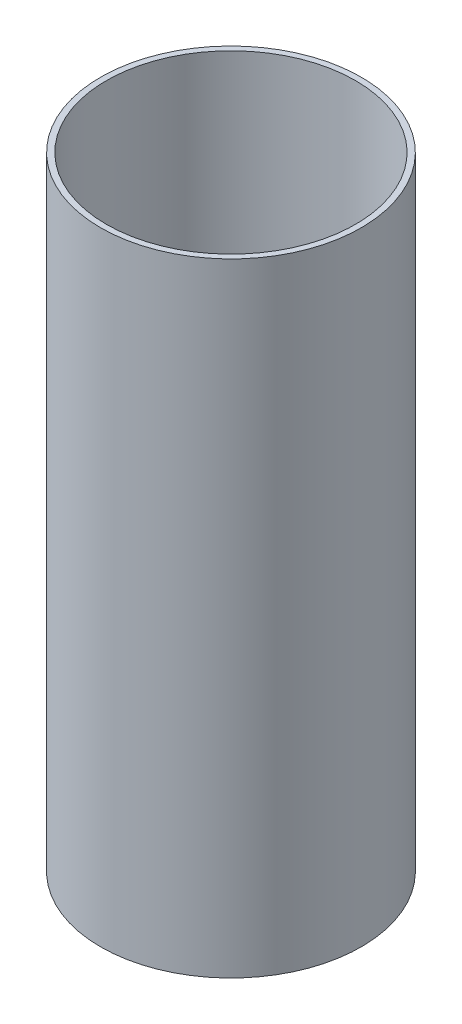
from build123d import *

# Parameters (mm, degrees)
SKETCH1_R           = 16.75
SKETCH1_R_2         = 16
BOSS_EXTRUDE1_DEPTH = 80


with BuildPart() as part:
    # Sketch1 → Boss-Extrude1 (new body)
    with BuildSketch(Plane(origin=(0, 0, 0), x_dir=(1, 0, 0), z_dir=(0, 1, 0))):
        with Locations(Location((0, 0, 0), (0, 0, 270))):
            Circle(SKETCH1_R)
        with Locations(Location((0, 0, 0), (0, 0, 270))):
            Circle(SKETCH1_R_2, mode=Mode.SUBTRACT)
    extrude(amount=BOSS_EXTRUDE1_DEPTH)


solid = part.part
